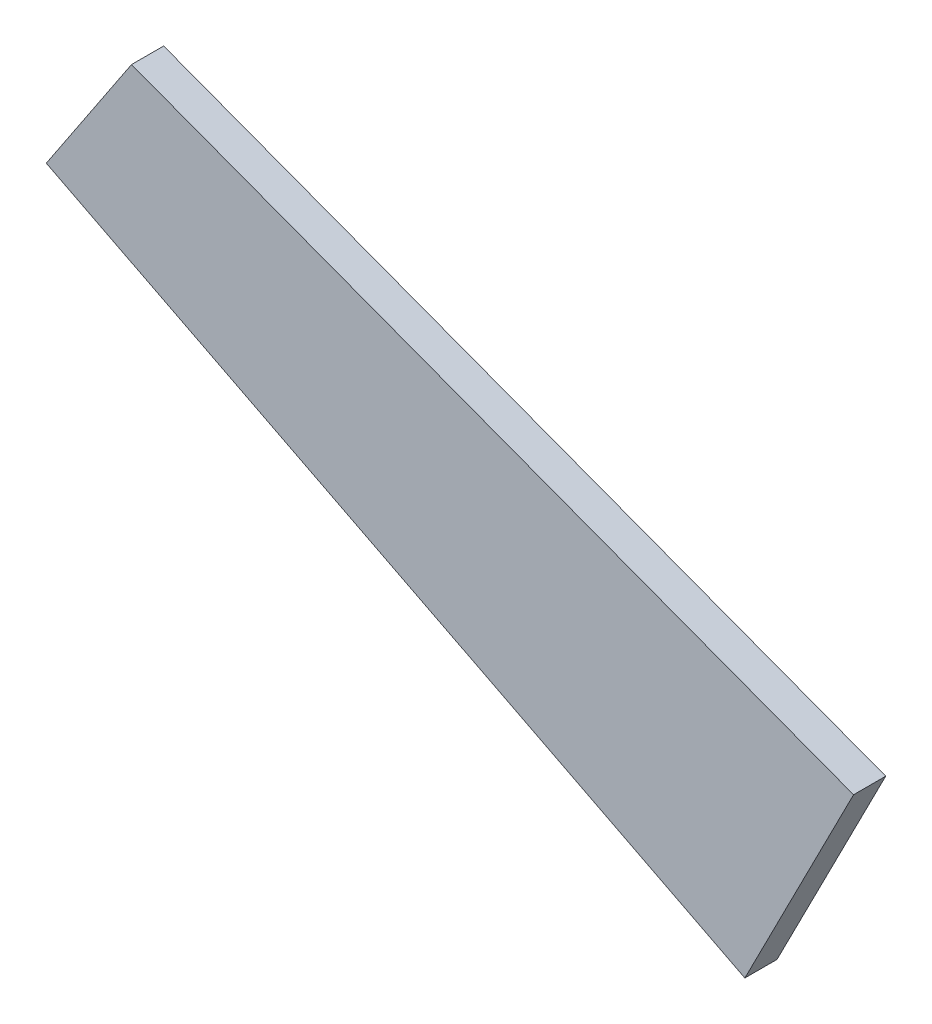
from build123d import *

# Parameters (mm, degrees)
BOSS_EXTRUDE1_DEPTH = 2.54


with BuildPart() as part:
    # Sketch1 → Boss-Extrude1 (new body)
    with BuildSketch(Plane.XY):
        Polygon((259.808460711, 74.78330048), (253.071131884, 64.662828502), (308.299508142, 36.488325419), (316.892233596, 53.332004014), align=None)
    extrude(amount=BOSS_EXTRUDE1_DEPTH)


solid = part.part
